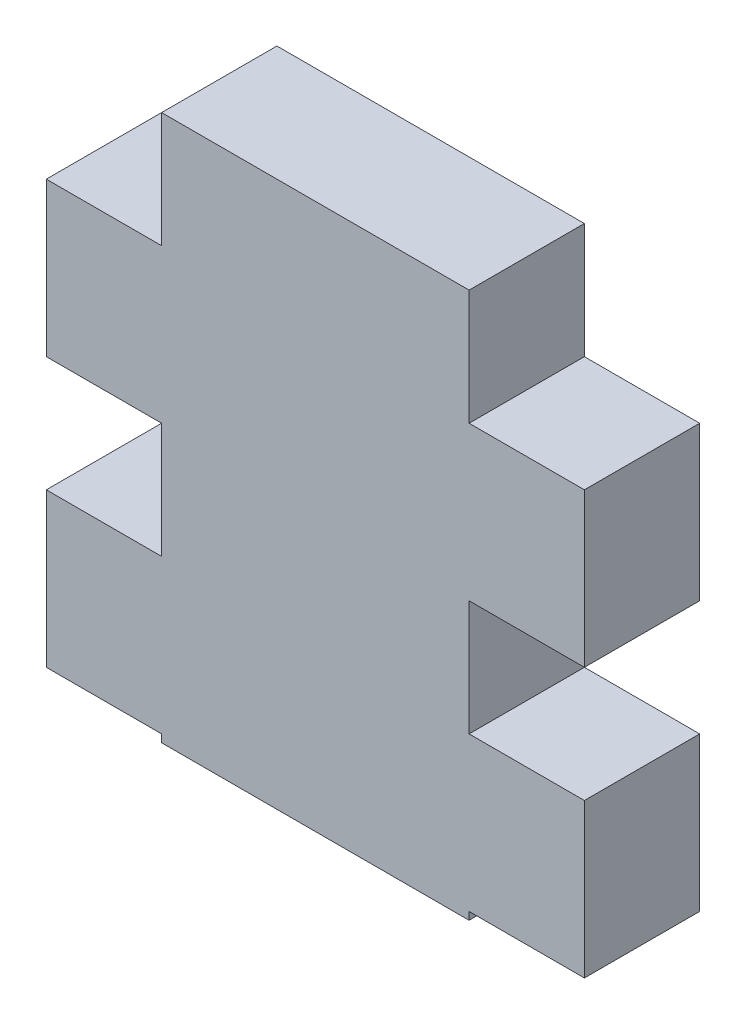
from build123d import *

# Parameters (mm, degrees)
SKETCH1_W           = 14
SKETCH1_H           = 14.2
BOSS_EXTRUDE1_DEPTH = 3
SKETCH2_W           = 3
SKETCH2_H           = 3
SKETCH2_H_2         = 0.2
CUT_EXTRUDE1_DEPTH  = 10
SKETCH4_W           = 3
SKETCH4_H           = 3
SKETCH4_H_2         = 0.2
CUT_EXTRUDE2_DEPTH  = 10


with BuildPart() as part:
    # Sketch1 → Boss-Extrude1 (new body)
    with BuildSketch(Plane.XY):
        Rectangle(SKETCH1_W, SKETCH1_H)
    extrude(amount=BOSS_EXTRUDE1_DEPTH)

    # Sketch2 → Cut-Extrude1 (cut)
    with BuildSketch(Plane.XY.offset(3)):
        with Locations((-5.5, 5.6)):
            Rectangle(SKETCH2_W, SKETCH2_H)
        with Locations((-5.5, -1.4)):
            Rectangle(SKETCH2_W, SKETCH2_H)
        with Locations((-5.5, -7)):
            Rectangle(SKETCH2_W, SKETCH2_H_2)
    extrude(amount=-CUT_EXTRUDE1_DEPTH, mode=Mode.SUBTRACT)

    # Sketch4 → Cut-Extrude2 (cut)
    with BuildSketch(Plane.XY.offset(3)):
        with Locations((5.5, 5.6)):
            Rectangle(SKETCH4_W, SKETCH4_H)
        with Locations((5.5, -1.4)):
            Rectangle(SKETCH4_W, SKETCH4_H)
        with Locations((5.5, -7)):
            Rectangle(SKETCH4_W, SKETCH4_H_2)
    extrude(amount=-CUT_EXTRUDE2_DEPTH, mode=Mode.SUBTRACT)


solid = part.part
